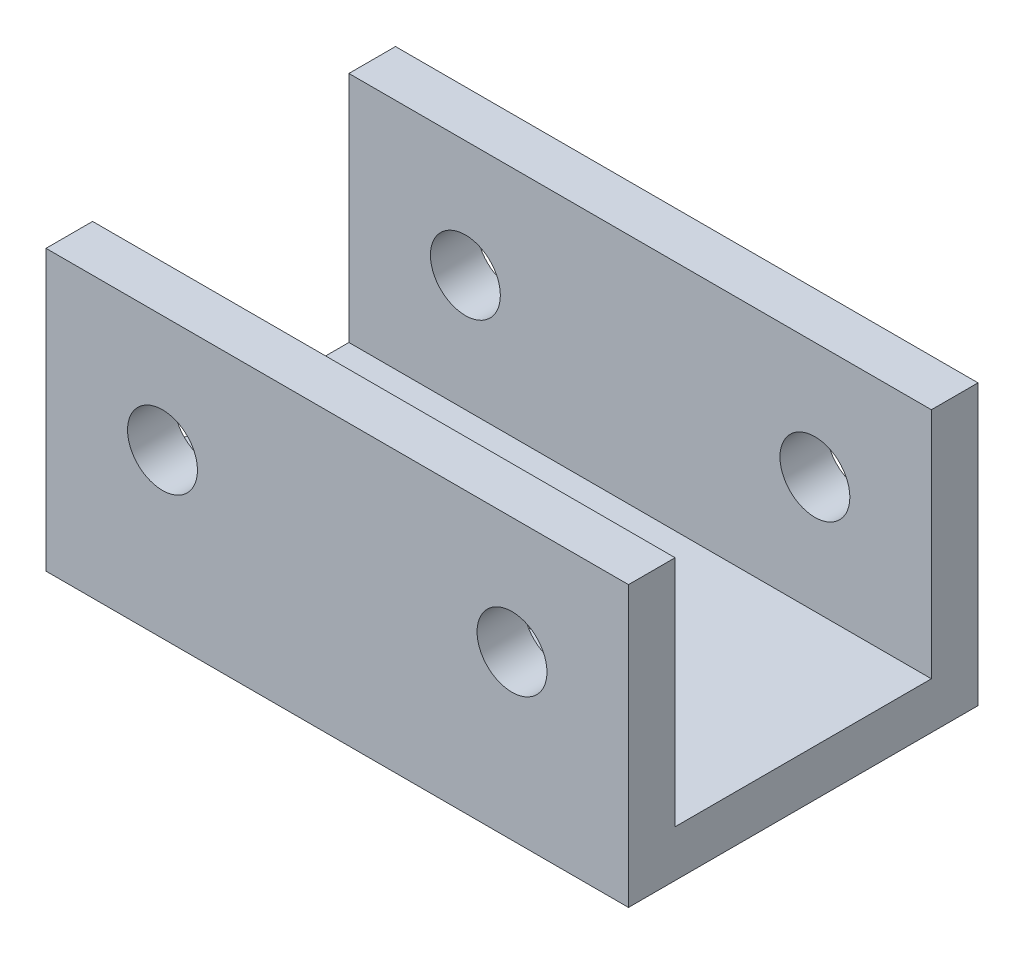
from build123d import *

# Parameters (mm, degrees)
SKETCH_1_W          = 100
SKETCH_1_H          = 60
EXTRUDE_1_DEPTH     = 48
SKETCH_2_W          = 104
SKETCH_2_H          = 44
CUT_EXTRUDE_1_DEPTH = 40
CUT_EXTRUDE_2_DEPTH = 76.524830354
SKETCH_4_R          = 6
CUT_EXTRUDE_3_DEPTH = 101


with BuildPart() as part:
    # 草图1 → 凸台-拉伸1 (new body)
    with BuildSketch(Plane(origin=(0, 0, 0), x_dir=(1, 0, 0), z_dir=(0, 1, 0))):
        Rectangle(SKETCH_1_W, SKETCH_1_H)
    extrude(amount=EXTRUDE_1_DEPTH)

    # 草图2 → 切除-拉伸1 (cut)
    with BuildSketch(Plane(origin=(0, 48, 0), x_dir=(1, 0, 0), z_dir=(0, 1, 0))):
        Rectangle(SKETCH_2_W, SKETCH_2_H)
    extrude(amount=-CUT_EXTRUDE_1_DEPTH, mode=Mode.SUBTRACT)

    # 草图3 → 切除-拉伸2 (cut, through all)
    with BuildSketch(Plane(origin=(0, 0, 0), x_dir=(1, 0, 0), z_dir=(0, 1, 0))):
        with BuildLine():
            Line((-15, 5), (15, 5))
            ThreePointArc((15, 5), (20, 0), (15, -5))
            Line((15, -5), (-15, -5))
            ThreePointArc((-15, -5), (-20, 0), (-15, 5))
        make_face()
    extrude(amount=CUT_EXTRUDE_2_DEPTH, mode=Mode.SUBTRACT)

    # 草图4 → 切除-拉伸3 (cut, symmetric)
    with BuildSketch(Plane.XY.offset(30)):
        with Locations((-30, 28)):
            Circle(SKETCH_4_R)
        with Locations((30, 28)):
            Circle(SKETCH_4_R)
    extrude(amount=CUT_EXTRUDE_3_DEPTH, both=True, mode=Mode.SUBTRACT)


solid = part.part
